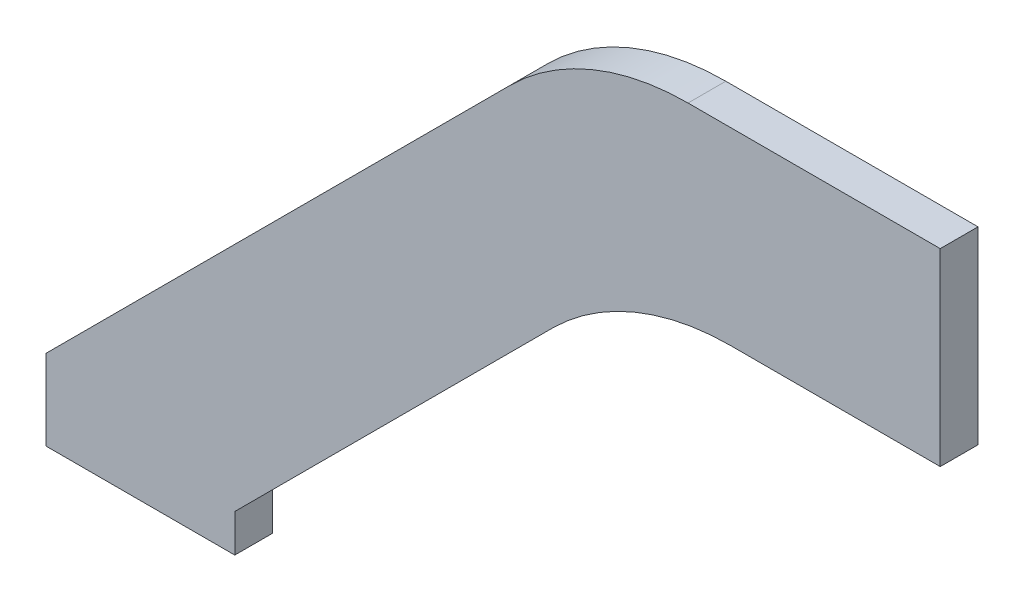
from build123d import *

# Parameters (mm, degrees)
BOSS_EXTRUDE1_DEPTH = 0.15
FILLET1_R           = 2


with BuildPart() as part:
    # Sketch1 → Boss-Extrude1 (new, symmetric)
    with BuildSketch(Plane.XY):
        Polygon((0, 0), (1.5, 0), (1.5, 0.3), (4.611269837, 3.411269837), (7.105, 3.411269837), (7.105, 4.911269837), (4.272792206, 4.911269837), (0, 0.638477631), align=None)
    extrude(amount=BOSS_EXTRUDE1_DEPTH, both=True)

    # Fillet1
    fillet1_edges = [part.edges().sort_by_distance(p)[0] for p in [
        (4.272792206, 4.911269837, 0),
        (4.611269837, 3.411269837, 0),
    ]]
    fillet(fillet1_edges, radius=FILLET1_R)


solid = part.part
